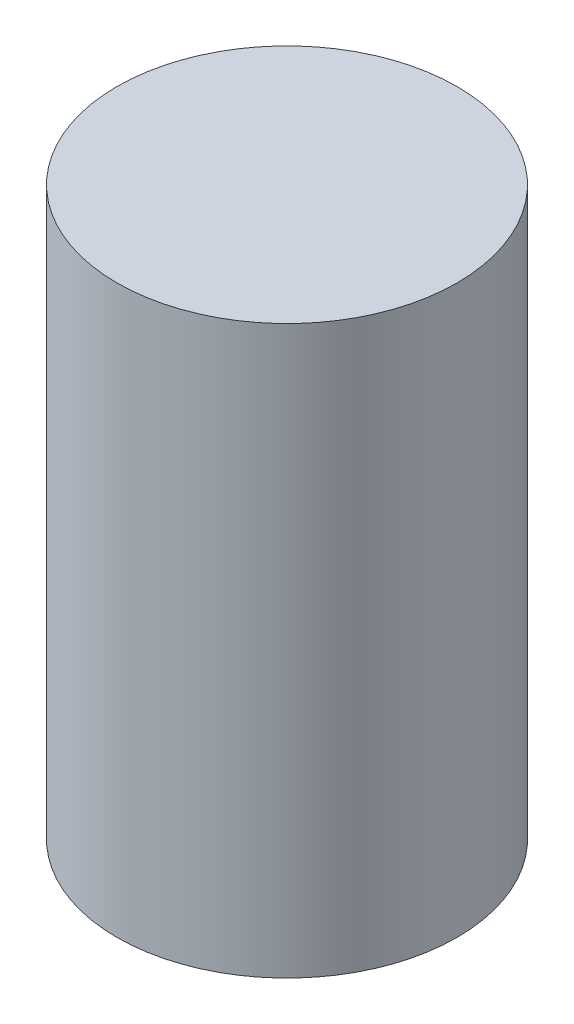
from build123d import *

# Parameters (mm, degrees)
STORE_SOG1_KOMPRESOR_START = 1680
SKETCH1_R                  = 60
STORE_SOG1_KOMPRESOR_DEPTH = 200


with BuildPart() as part:
    # Sketch1 → STORE_sog1_kompresor (new body)
    with BuildSketch(Plane(origin=(0, 0, 0), x_dir=(1, 0, 0), z_dir=(0, 1, 0)).offset(STORE_SOG1_KOMPRESOR_START)):
        with Locations(Location((180, 200, 0), (0, 0, 270))):
            Circle(SKETCH1_R)
    extrude(amount=STORE_SOG1_KOMPRESOR_DEPTH)


solid = part.part
